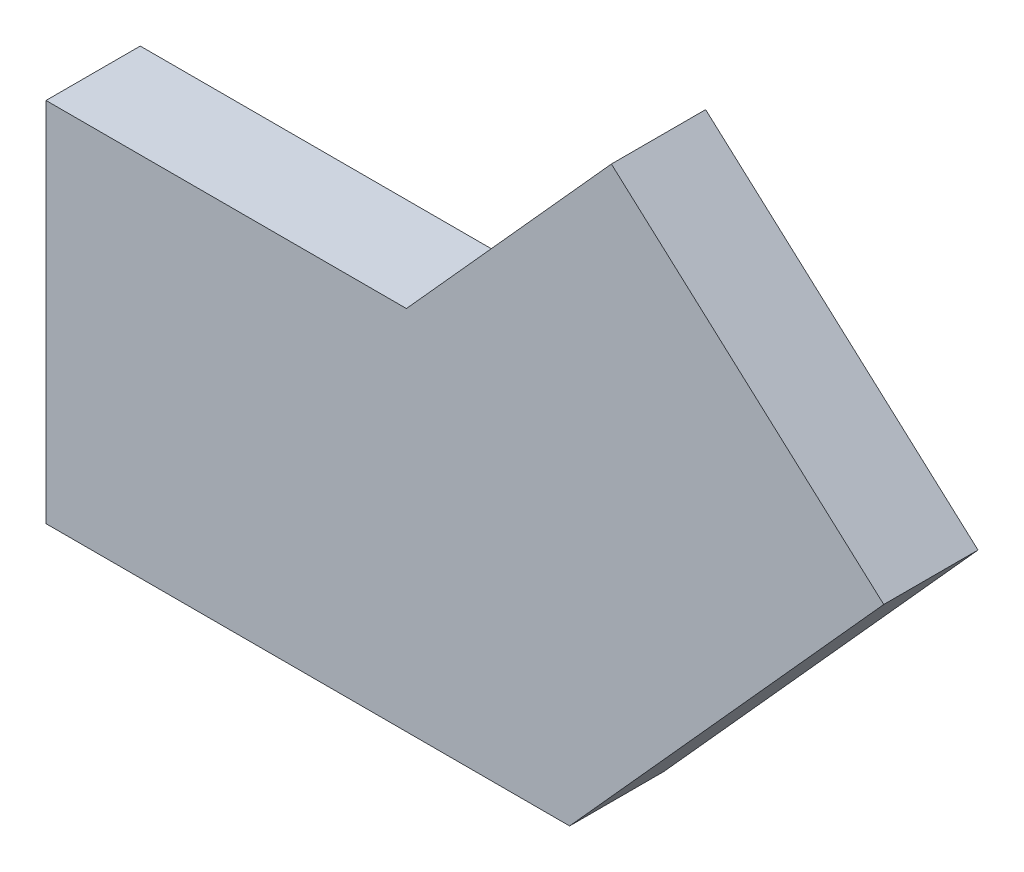
from build123d import *

# Parameters (mm, degrees)
BOSS_EXTRUDE1_DEPTH = 9


with BuildPart() as part:
    # Sketch1 → Boss-Extrude1 (new body)
    with BuildSketch(Plane.XY):
        Polygon((0, 0), (50, 0), (80, 33.318375445), (53.989931108, 56.737946667), (34.416996014, 35), (0, 35), align=None)
    extrude(amount=BOSS_EXTRUDE1_DEPTH)


solid = part.part
